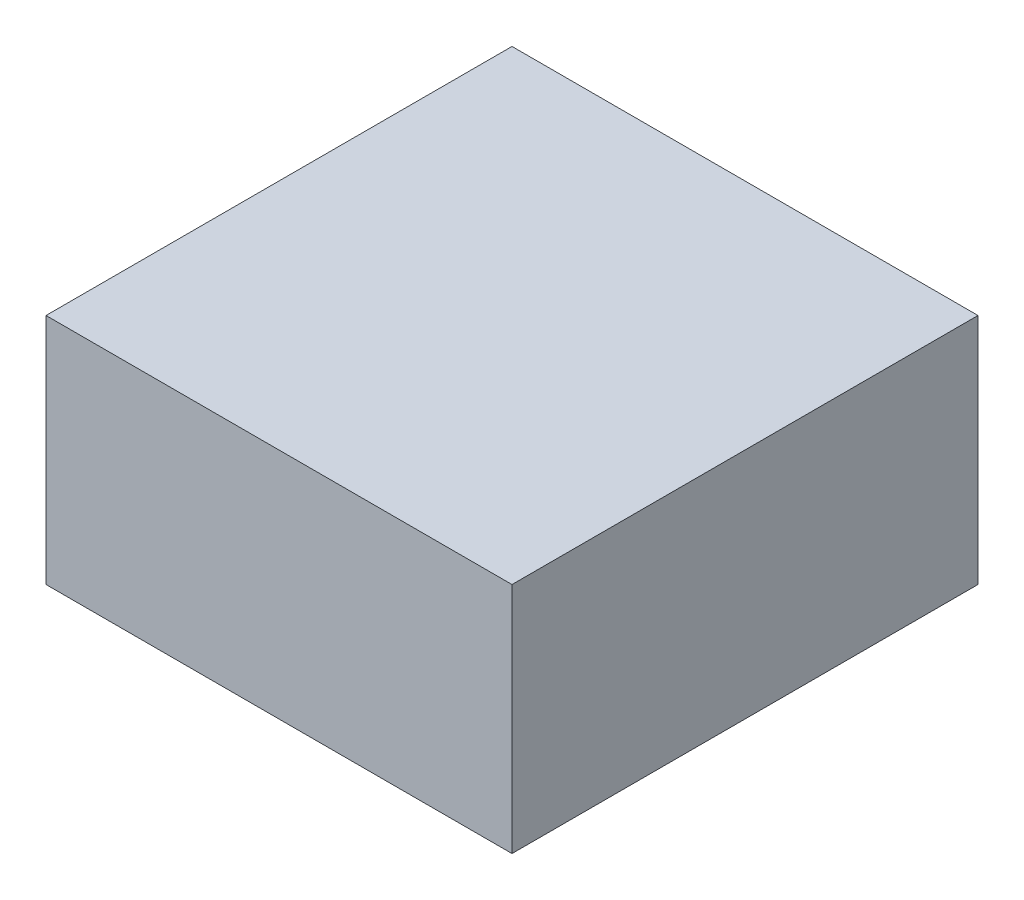
from build123d import *

# Parameters (mm, degrees)
SKETCH1_W           = 10
SKETCH1_H           = 5
BOSS_EXTRUDE1_DEPTH = 10


with BuildPart() as part:
    # Sketch1 → Boss-Extrude1 (new body)
    with BuildSketch(Plane(origin=(0, 0, 0), x_dir=(0, 0, -1), z_dir=(1, 0, 0))):
        with Locations((5, 2.5)):
            Rectangle(SKETCH1_W, SKETCH1_H)
    extrude(amount=BOSS_EXTRUDE1_DEPTH)


solid = part.part
